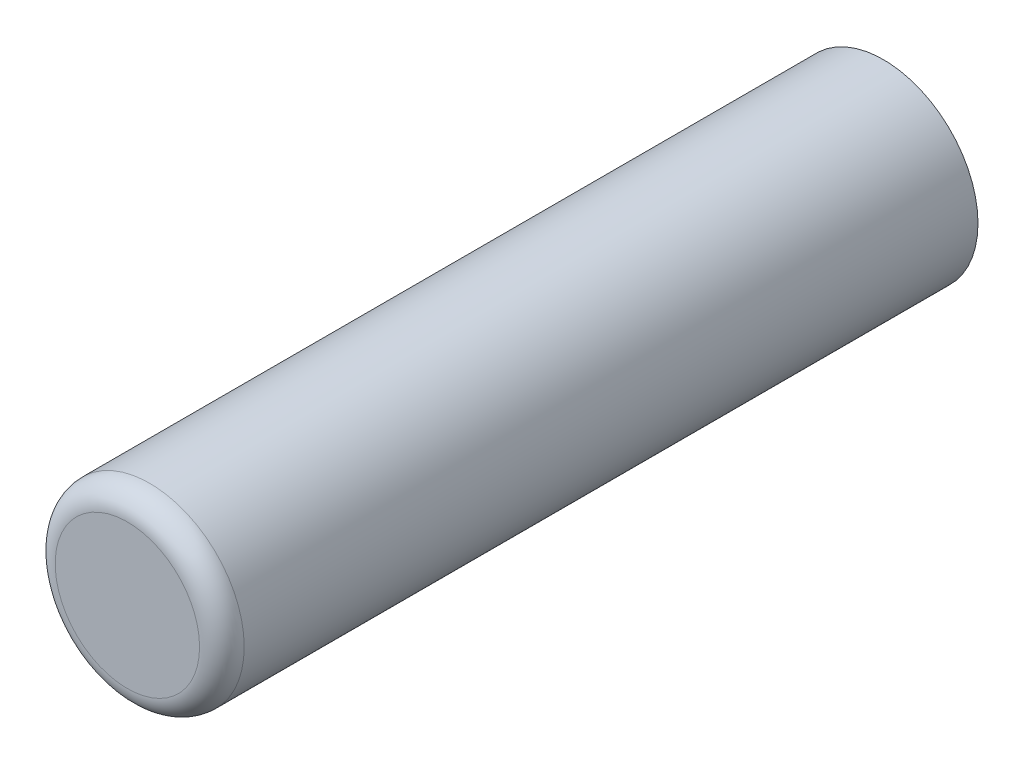
from build123d import *

# Parameters (mm, degrees)
SKETCH1_R           = 3.175
BOSS_EXTRUDE1_DEPTH = 25.4
FILLET1_R           = 0.75


with BuildPart() as part:
    # Sketch1 → Boss-Extrude1 (new body)
    with BuildSketch(Plane.XY):
        Circle(SKETCH1_R)
    extrude(amount=BOSS_EXTRUDE1_DEPTH)

    # Fillet1
    fillet1_edges = [part.edges().sort_by_distance(p)[0] for p in [
        (-3.175, 0, 25.4),
    ]]
    fillet(fillet1_edges, radius=FILLET1_R)


solid = part.part
